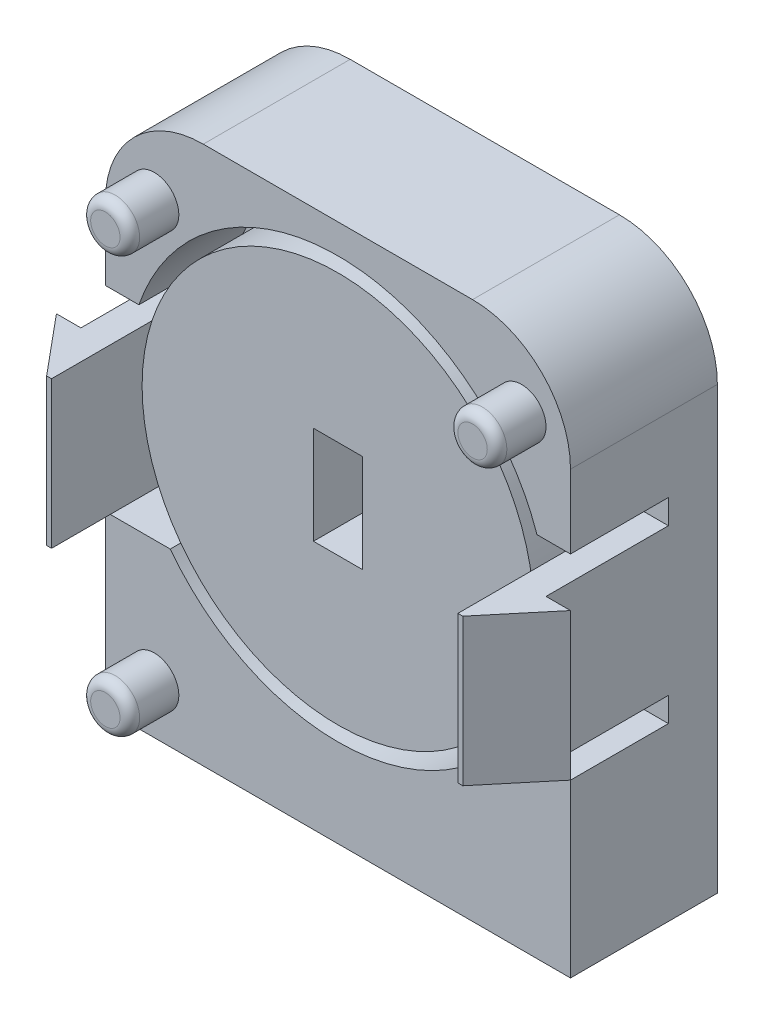
from build123d import *

# Parameters (mm, degrees)
SKETCH1_W           = 9.5
SKETCH1_H           = 11
BOSS_EXTRUDE1_DEPTH = 3
SKETCH2_R           = 4.3
CUT_EXTRUDE1_DEPTH  = 2
FILLET1_R           = 2
SKETCH3_W           = 9.5
SKETCH3_H           = 4
CUT_EXTRUDE2_DEPTH  = 2
SKETCH4_W           = 0.6
SKETCH4_H           = 3
BOSS_EXTRUDE2_DEPTH = 3.7
SKETCH5_W           = 0.5
SKETCH5_H           = 1.2
BOSS_EXTRUDE3_DEPTH = 3
CUT_EXTRUDE3_DEPTH  = 10.932396488
SKETCH7_R           = 0.5
BOSS_EXTRUDE4_DEPTH = 1
FILLET2_R           = 0.2
SKETCH8_R           = 4
SKETCH8_W           = 1
SKETCH8_H           = 2
BOSS_EXTRUDE5_DEPTH = 2


with BuildPart() as part:
    # Sketch1 → Boss-Extrude1 (new body)
    with BuildSketch(Plane.XY):
        Rectangle(SKETCH1_W, SKETCH1_H)
    extrude(amount=BOSS_EXTRUDE1_DEPTH)

    # Sketch2 → Cut-Extrude1 (cut)
    with BuildSketch(Plane.XY.offset(3)):
        with Locations((0, 0.6)):
            Circle(SKETCH2_R)
    extrude(amount=-CUT_EXTRUDE1_DEPTH, mode=Mode.SUBTRACT)

    # Fillet1
    fillet1_edges = [part.edges().sort_by_distance(p)[0] for p in [
        (-4.75, 5.5, 1.5),
        (4.75, 5.5, 1.5),
    ]]
    fillet(fillet1_edges, radius=FILLET1_R)

    # Sketch3 → Cut-Extrude2 (cut)
    with BuildSketch(Plane.XY.offset(3)):
        Rectangle(SKETCH3_W, SKETCH3_H)
    extrude(amount=-CUT_EXTRUDE2_DEPTH, mode=Mode.SUBTRACT)

    # Sketch4 → Boss-Extrude2 (add)
    with BuildSketch(Plane.XY.offset(1)):
        with Locations((-4.45, 0)):
            Rectangle(SKETCH4_W, SKETCH4_H)
        with Locations((4.45, 0)):
            Rectangle(SKETCH4_W, SKETCH4_H)
    extrude(amount=BOSS_EXTRUDE2_DEPTH)

    # Sketch5 → Boss-Extrude3 (add)
    with BuildSketch(Plane.XZ.offset(1.5)):
        with Locations((5, 4.1)):
            Rectangle(SKETCH5_W, SKETCH5_H)
        with Locations((-5, 4.1)):
            Rectangle(SKETCH5_W, SKETCH5_H)
    extrude(amount=-BOSS_EXTRUDE3_DEPTH)

    # Sketch6 → Cut-Extrude3 (cut, through all)
    with BuildSketch(Plane.XZ.offset(1.5)):
        Polygon((5.25, 3.5), (4.25, 4.7), (5.25, 4.7), align=None)
        Polygon((-5.25, 3.5), (-4.25, 4.7), (-5.25, 4.7), align=None)
    extrude(amount=-CUT_EXTRUDE3_DEPTH, mode=Mode.SUBTRACT)

    # Sketch7 → Boss-Extrude4 (add)
    with BuildSketch(Plane.XY.offset(3)):
        with Locations(Location((-3.75, 4, 0), (0, 0, 180))):
            Circle(SKETCH7_R)
        with Locations(Location((3.75, 4, 0), (0, 0, 180))):
            Circle(SKETCH7_R)
        with Locations(Location((-3.75, -4.5, 0), (0, 0, 180))):
            Circle(SKETCH7_R)
    extrude(amount=BOSS_EXTRUDE4_DEPTH)

    # Fillet2
    fillet2_edges = [part.edges().sort_by_distance(p)[0] for p in [
        (-3.25, 4, 4),
        (4.25, 4, 4),
        (-3.25, -4.5, 4),
    ]]
    fillet(fillet2_edges, radius=FILLET2_R)

    # Sketch8 → Boss-Extrude5 (add)
    with BuildSketch(Plane.XY.offset(1)):
        with Locations(Location((0, 0.6, 0), (0, 0, 180))):
            Circle(SKETCH8_R)
        with Locations((0, 0.6)):
            Rectangle(SKETCH8_W, SKETCH8_H, mode=Mode.SUBTRACT)
    extrude(amount=BOSS_EXTRUDE5_DEPTH)


solid = part.part
